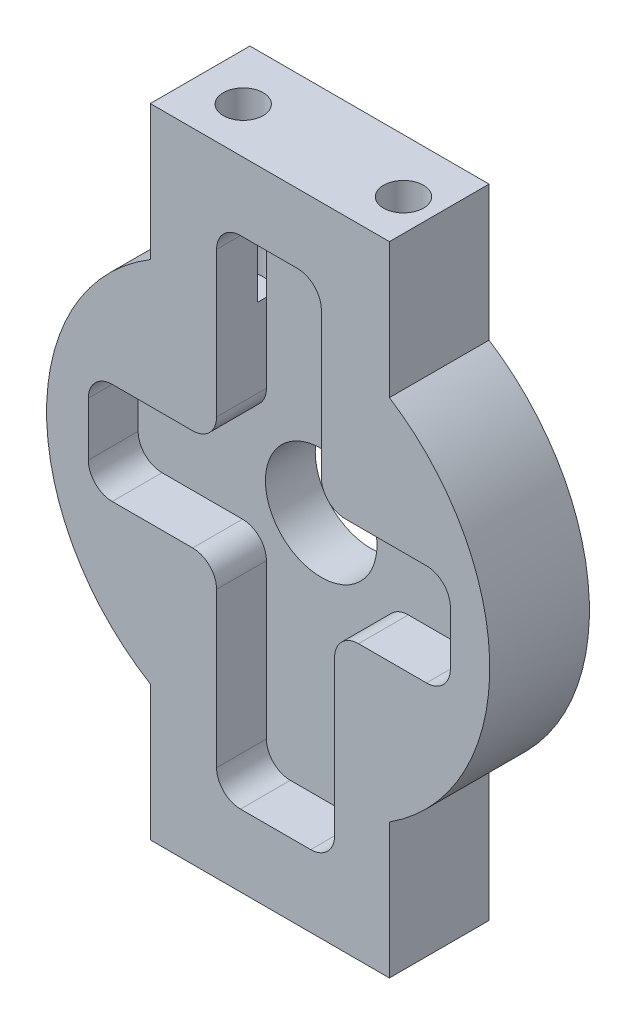
from build123d import *

# Parameters (mm, degrees)
SKETCH1_R           = 2.8
BOSS_EXTRUDE1_DEPTH = 5
CUT_EXTRUDE1_DEPTH  = 2.5
FILLET1_R           = 1.2
SKETCH3_R           = 1
CUT_EXTRUDE2_DEPTH  = 8
SKETCH4_R           = 1
CUT_EXTRUDE3_DEPTH  = 8


with BuildPart() as part:
    # Sketch1 → Boss-Extrude1 (new body)
    with BuildSketch(Plane.XY.offset(10)):
        with BuildLine():
            Line((-253, 240), (-241, 240))
            Line((-241, 240), (-241, 233.219543457))
            ThreePointArc((-241, 233.219543457), (-235.964643127, 224), (-241, 214.780456543))
            Line((-241, 214.780456543), (-241, 208))
            Line((-241, 208), (-253, 208))
            Line((-253, 208), (-253, 214.780456543))
            ThreePointArc((-253, 214.780456543), (-258.20228405, 224), (-253, 233.219543457))
            Line((-253, 233.219543457), (-253, 240))
        make_face()
        with Locations((-246.922635101, 224)):
            Circle(SKETCH1_R, mode=Mode.SUBTRACT)
    extrude(amount=BOSS_EXTRUDE1_DEPTH)

    # Sketch2 → Cut-Extrude1 (cut)
    with BuildSketch(Plane.XY.offset(15)):
        Polygon((-249.671711, 236.526764937), (-244.414971283, 236.526764937), (-244.414971283, 226.843297037), (-237.940881316, 226.843297037), (-237.940881316, 221.752559627), (-243.750962055, 221.752559627), (-243.750962055, 211.604094919), (-249.671711, 211.604094919), (-249.671711, 221.752559627), (-256.108895334, 221.752559627), (-256.108895334, 226.843297037), (-249.671711, 226.843297037), align=None)
    extrude(amount=-CUT_EXTRUDE1_DEPTH, mode=Mode.SUBTRACT)

    # Fillet1
    fillet1_edges = [part.edges().sort_by_distance(p)[0] for p in [
        (-249.671711, 226.843297037, 13.75),
        (-249.671711, 236.526764937, 13.75),
        (-244.414971283, 236.526764937, 13.75),
        (-244.414971283, 226.843297037, 13.75),
        (-237.940881316, 226.843297037, 13.75),
        (-237.940881316, 221.752559627, 13.75),
        (-243.750962055, 221.752559627, 13.75),
        (-243.750962055, 211.604094919, 13.75),
        (-249.671711, 211.604094919, 13.75),
        (-249.671711, 221.752559627, 13.75),
        (-256.108895334, 221.752559627, 13.75),
        (-256.108895334, 226.843297037, 13.75),
    ]]
    fillet(fillet1_edges, radius=FILLET1_R)

    # Sketch3 → Cut-Extrude2 (cut)
    with BuildSketch(Plane(origin=(0, 208, 0), x_dir=(-1, 0, 0), z_dir=(0, -1, 0))):
        with Locations(Location((250.9, -12.2, 0), (0, 0, 90))):
            Circle(SKETCH3_R)
        with Locations(Location((242.9, -12.2, 0), (0, 0, 90))):
            Circle(SKETCH3_R)
    extrude(amount=-CUT_EXTRUDE2_DEPTH, mode=Mode.SUBTRACT)

    # Sketch4 → Cut-Extrude3 (cut)
    with BuildSketch(Plane(origin=(0, 240, 0), x_dir=(1, 0, 0), z_dir=(0, 1, 0))):
        with Locations(Location((-242.598801613, -12.694978247, 0), (0, 0, 270))):
            Circle(SKETCH4_R)
        with Locations(Location((-250.64051394, -12.694978247, 0), (0, 0, 270))):
            Circle(SKETCH4_R)
    extrude(amount=-CUT_EXTRUDE3_DEPTH, mode=Mode.SUBTRACT)


solid = part.part
